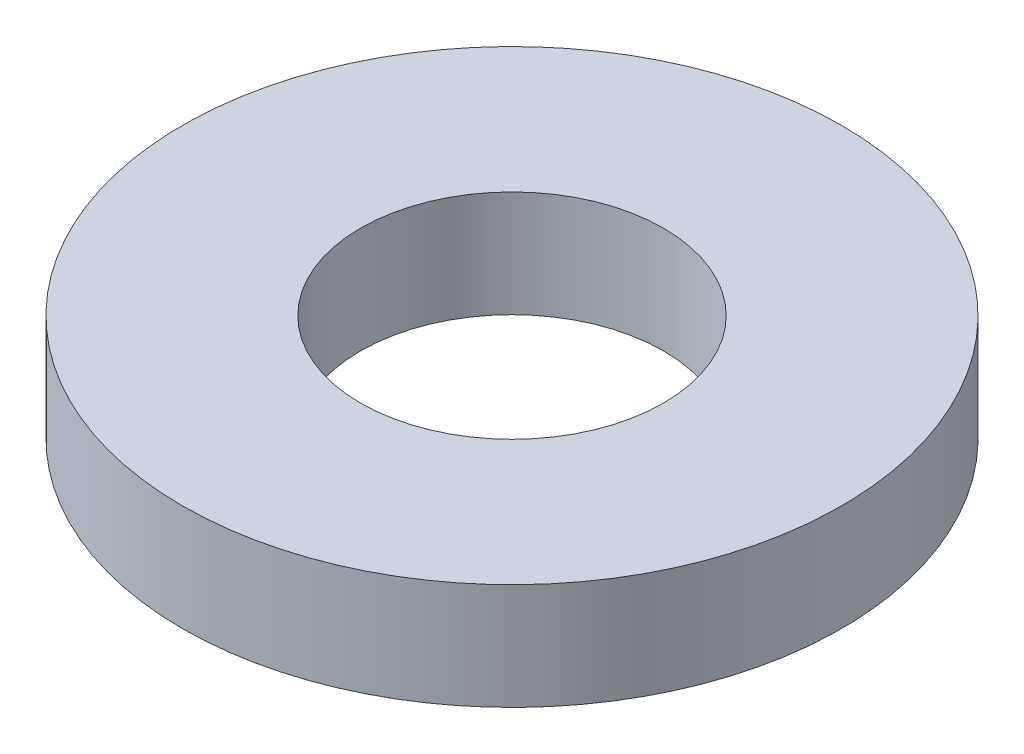
from build123d import *

# Parameters (mm, degrees)
SKETCH1_R           = 3.1
SKETCH1_R_2         = 1.425
BOSS_EXTRUDE1_DEPTH = 1


with BuildPart() as part:
    # Sketch1 → Boss-Extrude1 (new body)
    with BuildSketch(Plane(origin=(0, 0, 0), x_dir=(1, 0, 0), z_dir=(0, 1, 0))):
        with Locations(Location((0, 0, 0), (0, 0, 270))):
            Circle(SKETCH1_R)
        with Locations(Location((0, 0, 0), (0, 0, 270))):
            Circle(SKETCH1_R_2, mode=Mode.SUBTRACT)
    extrude(amount=BOSS_EXTRUDE1_DEPTH)


solid = part.part
